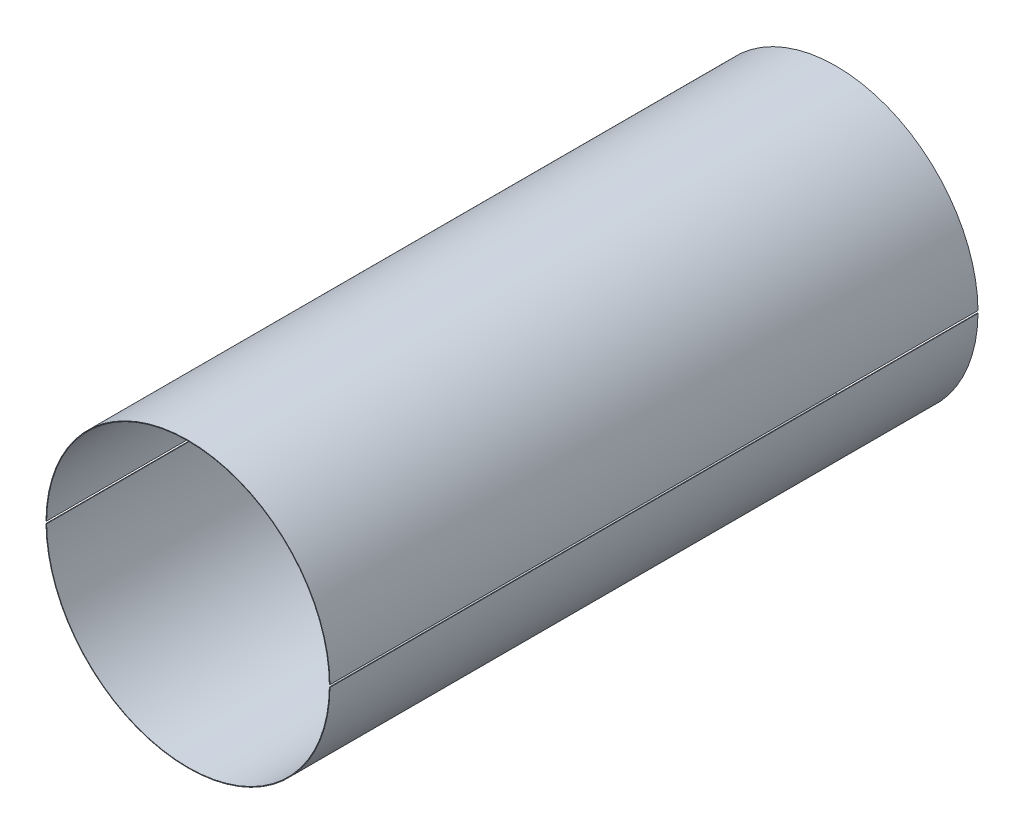
from build123d import *

# Parameters (mm, degrees)
SKETCH2_R               = 61.214
SKETCH2_R_2             = 60.96
BOSS_EXTRUDE1_DEPTH     = 279.4
CUT_EXTRUDE1_DEPTH      = 312.127191001
CUT_EXTRUDE1_DEPTH_BACK = 312.127191001
SKETCH5_W               = 279.4
SKETCH5_H               = 1.016


with BuildPart() as part:
    # Sketch2 → Boss-Extrude1 (new body)
    with BuildSketch(Plane.XY):
        Circle(SKETCH2_R)
        Circle(SKETCH2_R_2, mode=Mode.SUBTRACT)
    extrude(amount=BOSS_EXTRUDE1_DEPTH)

    # Sketch5 → Cut-Extrude1 (cut, two sides: drawn at the far end of the back side and taken through both)
    with BuildSketch(Plane.ZY.offset(61.214).offset(-CUT_EXTRUDE1_DEPTH_BACK)):
        with Locations((139.7, 0)):
            Rectangle(SKETCH5_W, SKETCH5_H)
    extrude(amount=CUT_EXTRUDE1_DEPTH + CUT_EXTRUDE1_DEPTH_BACK, mode=Mode.SUBTRACT)


with BuildPart() as cut_extrude1_piece_1:
    # of the separate pieces the step leaves, piece 1, a body of its own (cut_extrude1_pieces)
    add(part.part.solids().sort_by_distance((61.21189208, 0.508, 0))[0])


with BuildPart() as cut_extrude1_piece_2:
    # of the separate pieces the step leaves, piece 2, a body of its own (cut_extrude1_pieces)
    add(part.part.solids().sort_by_distance((-61.21189208, -0.508, 0))[0])


solid = Compound([cut_extrude1_piece_1.part, cut_extrude1_piece_2.part])
